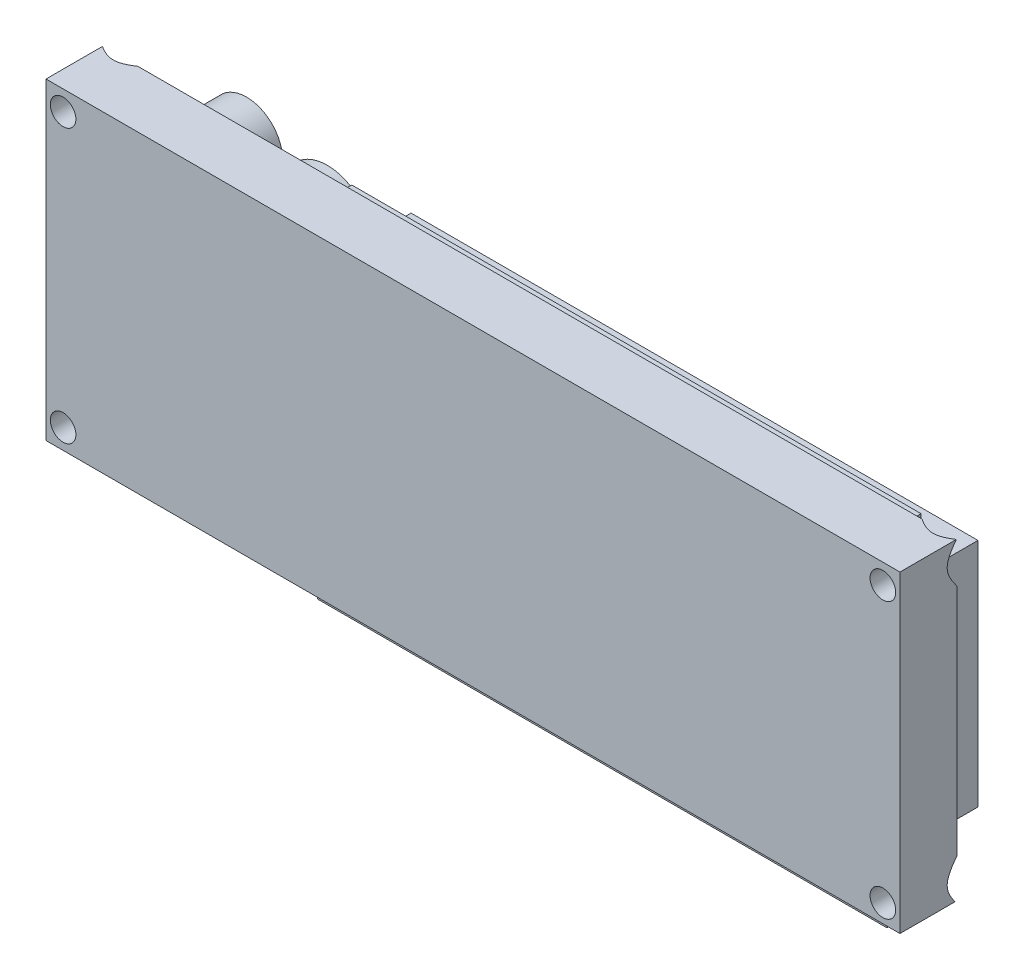
from build123d import *

# Parameters (mm, degrees)
SKETCH1_W                                           = 150
SKETCH1_H                                           = 55
BOSS_EXTRUDE1_DEPTH                                 = 10
CSK_FOR_M4_COUNTERSUNK_FLAT_HEAD_SCREW1_D           = 4.5
CSK_FOR_M4_COUNTERSUNK_FLAT_HEAD_SCREW1_CSINK_D     = 9.4
CSK_FOR_M4_COUNTERSUNK_FLAT_HEAD_SCREW1_CSINK_ANGLE = 90
SKETCH4_W                                           = 100
SKETCH4_H                                           = 60
BOSS_EXTRUDE2_DEPTH                                 = 6
SKETCH5_W                                           = 99.587167191
SKETCH5_H                                           = 40.554359572
BOSS_EXTRUDE3_DEPTH                                 = 10
SKETCH6_R                                           = 6.325350673
BOSS_EXTRUDE4_DEPTH                                 = 10
SKETCH7_R                                           = 6.761038659
SKETCH7_W                                           = 5.613398263
SKETCH7_H                                           = 5.940244602
BOSS_EXTRUDE5_DEPTH                                 = 5
SKETCH8_R                                           = 7.825257062
BOSS_EXTRUDE6_DEPTH                                 = 20


with BuildPart() as part:
    # Sketch1 → Boss-Extrude1 (new body)
    with BuildSketch(Plane.XY):
        Rectangle(SKETCH1_W, SKETCH1_H)
    extrude(amount=BOSS_EXTRUDE1_DEPTH)

    # CSK for M4 Countersunk Flat Head Screw1 (through all)
    with Locations(Plane(origin=(0, 0, 0), x_dir=(-1, 0, 0), z_dir=(0, 0, -1))):
        with Locations((-72, 24), (-72, -24.31977753), (72, -24), (72, 24)):
            CounterSinkHole(CSK_FOR_M4_COUNTERSUNK_FLAT_HEAD_SCREW1_D / 2, CSK_FOR_M4_COUNTERSUNK_FLAT_HEAD_SCREW1_CSINK_D / 2, counter_sink_angle=CSK_FOR_M4_COUNTERSUNK_FLAT_HEAD_SCREW1_CSINK_ANGLE)

    # Sketch4 → Boss-Extrude2 (add)
    with BuildSketch(Plane(origin=(0, 0, 0), x_dir=(-1, 0, 0), z_dir=(0, 0, -1))):
        with Locations((-12.709987385, -7.767861044)):
            Rectangle(SKETCH4_W, SKETCH4_H)
    extrude(amount=BOSS_EXTRUDE2_DEPTH)

    # Sketch5 → Boss-Extrude3 (add)
    with BuildSketch(Plane(origin=(0, 0, -6), x_dir=(-1, 0, 0), z_dir=(0, 0, -1))):
        with Locations((-12.91640379, -7.112004415)):
            Rectangle(SKETCH5_W, SKETCH5_H)
    extrude(amount=BOSS_EXTRUDE3_DEPTH)

    # Sketch6 → Boss-Extrude4 (add)
    with BuildSketch(Plane(origin=(0, 0, 0), x_dir=(-1, 0, 0), z_dir=(0, 0, -1))):
        with Locations(Location((59.771620242, 16.04141059, 0), (0, 0, 180))):
            Circle(SKETCH6_R)
    extrude(amount=BOSS_EXTRUDE4_DEPTH)

    # Sketch7 → Boss-Extrude5 (add)
    with BuildSketch(Plane(origin=(0, 0, 0), x_dir=(-1, 0, 0), z_dir=(0, 0, -1))):
        with Locations(Location((60.574566505, -3.736064786, 0), (0, 0, 180))):
            Circle(SKETCH7_R)
        with Locations((60.574566506, -19.28347932)):
            Rectangle(SKETCH7_W, SKETCH7_H)
    extrude(amount=BOSS_EXTRUDE5_DEPTH)

    # Sketch8 → Boss-Extrude6 (add)
    with BuildSketch(Plane(origin=(0, 0, -5), x_dir=(-1, 0, 0), z_dir=(0, 0, -1))):
        with Locations((60.574566505, -3.736064786)):
            Circle(SKETCH8_R)
    extrude(amount=BOSS_EXTRUDE6_DEPTH)


solid = part.part
